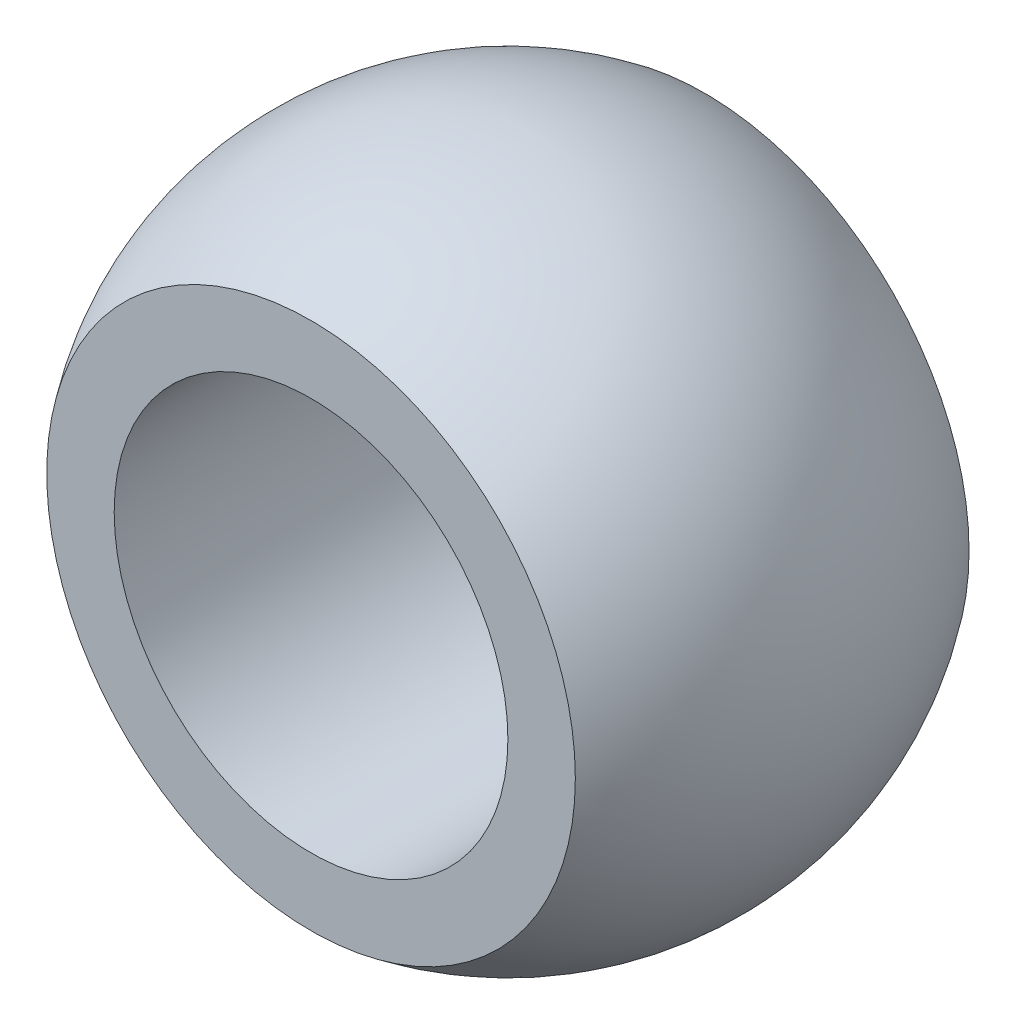
from build123d import *

# Parameters (mm, degrees)
EXTRUDE1_DEPTH      = 5.124445986
EXTRUDE1_DEPTH_BACK = 5.124445986
SKETCH4_R           = 1.4224
SKETCH5_OUTSIDE_W   = 8.412
SKETCH5_OUTSIDE_H   = 8.412
SKETCH5_OUTSIDE_R   = 1.4224
EXTRUDE2_DEPTH      = 2.54
SKETCH6_OUTSIDE_W   = 8.412
SKETCH6_OUTSIDE_H   = 8.412
SKETCH6_OUTSIDE_R   = 1.4224
EXTRUDE3_DEPTH      = 2.54


with BuildPart() as part:
    # Sketch2 → Revolve2 (revolve)
    with BuildSketch(Plane.XY):
        with BuildLine():
            Line((0, 2.38125), (0, -2.38125))
            ThreePointArc((0, -2.38125), (2.38125, 0), (0, 2.38125))
        make_face()
    revolve(axis=Axis((0, 2.38125, 0), (0, -1, 0)))

    # Sketch4 → Extrude1 (cut, two sides: drawn at the far end of the back side and taken through both)
    with BuildSketch(Plane.XY.offset(-EXTRUDE1_DEPTH_BACK)):
        with Locations(Location((0, 0, 0), (0, 0, 180))):
            Circle(SKETCH4_R)
    extrude(amount=EXTRUDE1_DEPTH + EXTRUDE1_DEPTH_BACK, mode=Mode.SUBTRACT)

    # Sketch5 outside → Extrude2 (cut)
    with BuildSketch(Plane.XY.offset(-1.4224)):
        Rectangle(SKETCH5_OUTSIDE_W, SKETCH5_OUTSIDE_H)
        with Locations(Location((0, 0, 0), (0, 0, 180))):
            Circle(SKETCH5_OUTSIDE_R, mode=Mode.SUBTRACT)
    extrude(amount=-EXTRUDE2_DEPTH, mode=Mode.SUBTRACT)

    # Sketch6 outside → Extrude3 (cut)
    with BuildSketch(Plane.XY.offset(1.4224)):
        Rectangle(SKETCH6_OUTSIDE_W, SKETCH6_OUTSIDE_H)
        with Locations(Location((0, 0, 0), (0, 0, 180))):
            Circle(SKETCH6_OUTSIDE_R, mode=Mode.SUBTRACT)
    extrude(amount=EXTRUDE3_DEPTH, mode=Mode.SUBTRACT)


solid = part.part
